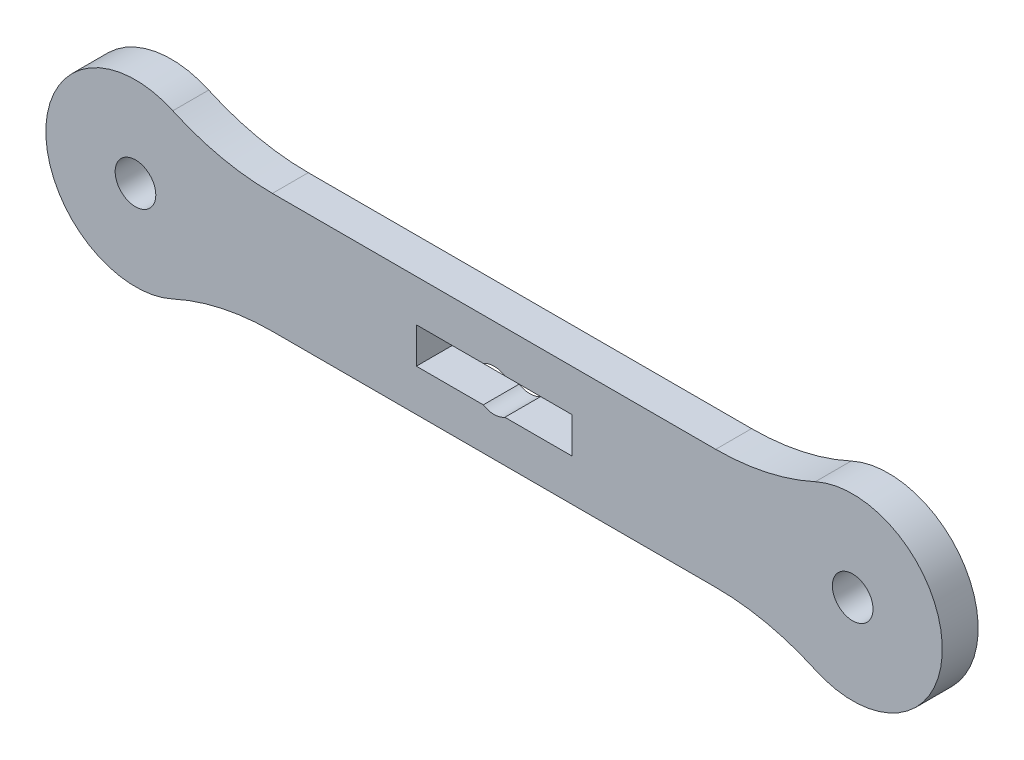
from build123d import *

# Parameters (mm, degrees)
ESBO_O1_R                = 1.7
RESSALTO_EXTRUS_O1_DEPTH = 3
FILETE1_R                = 20


with BuildPart() as part:
    # Esboço1 → Ressalto-extrusão1 (new body)
    with BuildSketch(Plane.XY):
        with BuildLine():
            Line((5.590169944, -5), (54.409830056, -5))
            ThreePointArc((54.409830056, -5), (67.5, 0), (54.409830056, 5))
            Line((54.409830056, 5), (5.590169944, 5))
            ThreePointArc((5.590169944, 5), (-7.5, 0), (5.590169944, -5))
        make_face()
        Circle(ESBO_O1_R, mode=Mode.SUBTRACT)
        with Locations((60, 0)):
            Circle(ESBO_O1_R, mode=Mode.SUBTRACT)
        with BuildLine():
            Line((30.901387819, -1.5), (36.5, -1.5))
            Line((36.5, -1.5), (36.5, 1.5))
            Line((36.5, 1.5), (30.901387819, 1.5))
            ThreePointArc((30.901387819, 1.5), (30, 1.75), (29.098612181, 1.5))
            Line((29.098612181, 1.5), (23.5, 1.5))
            Line((23.5, 1.5), (23.5, -1.5))
            Line((23.5, -1.5), (29.098612181, -1.5))
            ThreePointArc((29.098612181, -1.5), (30, -1.75), (30.901387819, -1.5))
        make_face(mode=Mode.SUBTRACT)
    extrude(amount=RESSALTO_EXTRUS_O1_DEPTH)

    # Filete1
    filete1_edges = [part.edges().sort_by_distance(p)[0] for p in [
        (54.409830056, -5, 1.5),
        (5.590169944, -5, 1.5),
        (5.590169944, 5, 1.5),
        (54.409830056, 5, 1.5),
    ]]
    fillet(filete1_edges, radius=FILETE1_R)


solid = part.part
